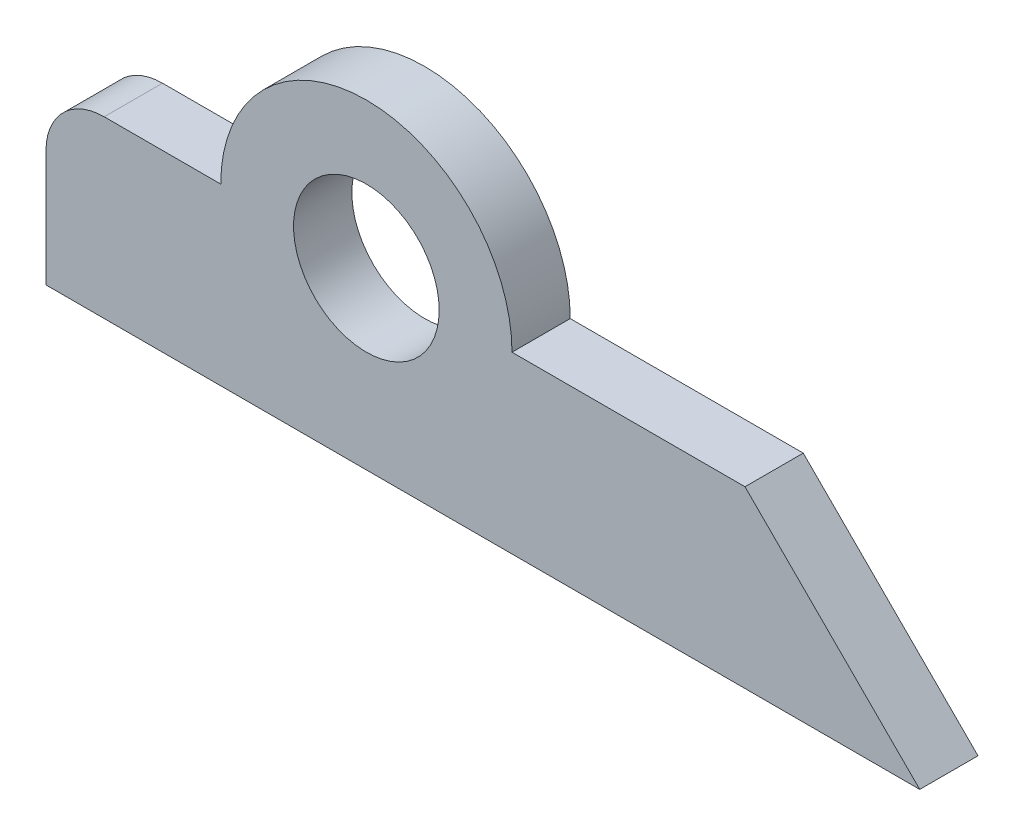
from build123d import *

# Parameters (mm, degrees)
SKETCH1_R           = 12.5
BOSS_EXTRUDE1_DEPTH = 10


with BuildPart() as part:
    # Sketch1 → Boss-Extrude1 (new body)
    with BuildSketch(Plane.XY):
        with BuildLine():
            Line((-25, 0), (-45, 0))
            ThreePointArc((-45, 0), (-52.071067812, -2.928932188), (-55, -10))
            Line((-55, -10), (-55, -30))
            Line((-55, -30), (95, -30))
            Line((95, -30), (65, 0))
            Line((65, 0), (25, 0))
            ThreePointArc((25, 0), (0, 25), (-25, 0))
        make_face()
        Circle(SKETCH1_R, mode=Mode.SUBTRACT)
    extrude(amount=BOSS_EXTRUDE1_DEPTH)


solid = part.part
